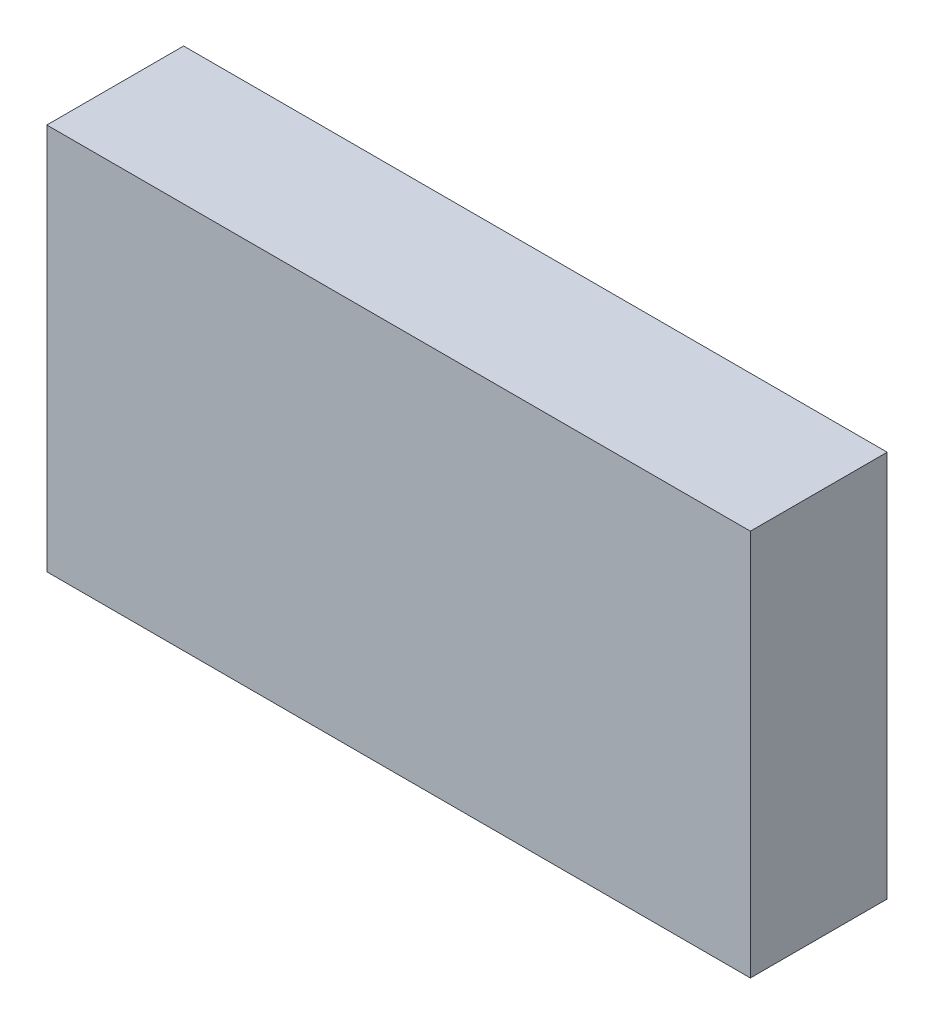
from build123d import *

# Parameters (mm, degrees)
SKETCH1_W           = 36
SKETCH1_H           = 19.8
BOSS_EXTRUDE1_DEPTH = 7


with BuildPart() as part:
    # Sketch1 → Boss-Extrude1 (new body)
    with BuildSketch(Plane.XY):
        with Locations((18, 9.9)):
            Rectangle(SKETCH1_W, SKETCH1_H)
    extrude(amount=BOSS_EXTRUDE1_DEPTH)


solid = part.part
